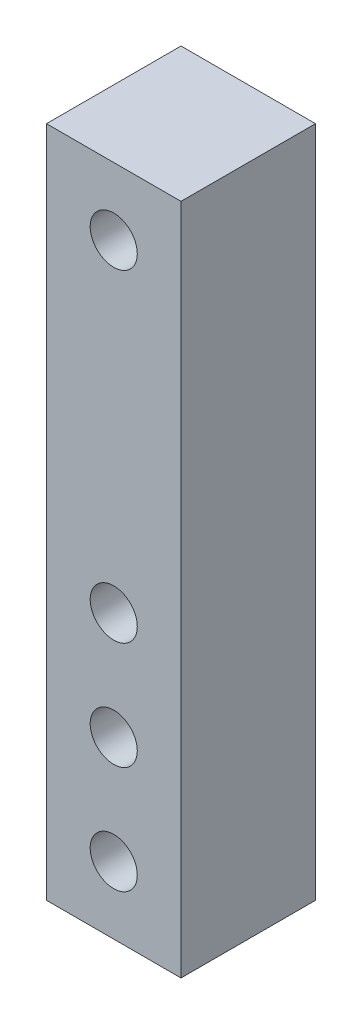
from build123d import *

# Parameters (mm, degrees)
SKETCH_1_W      = 10
SKETCH_1_H      = 50
SKETCH_1_R      = 1.75
EXTRUDE_1_DEPTH = 10


with BuildPart() as part:
    # ｽｹｯﾁ1 → ﾎﾞｽ - 押し出し1 (new body)
    with BuildSketch(Plane.XY):
        Rectangle(SKETCH_1_W, SKETCH_1_H)
        with Locations((0, -20)):
            Circle(SKETCH_1_R, mode=Mode.SUBTRACT)
        with Locations((0, -12)):
            Circle(SKETCH_1_R, mode=Mode.SUBTRACT)
        with Locations((0, -4)):
            Circle(SKETCH_1_R, mode=Mode.SUBTRACT)
        with Locations((0, 20)):
            Circle(SKETCH_1_R, mode=Mode.SUBTRACT)
    extrude(amount=EXTRUDE_1_DEPTH)


solid = part.part
